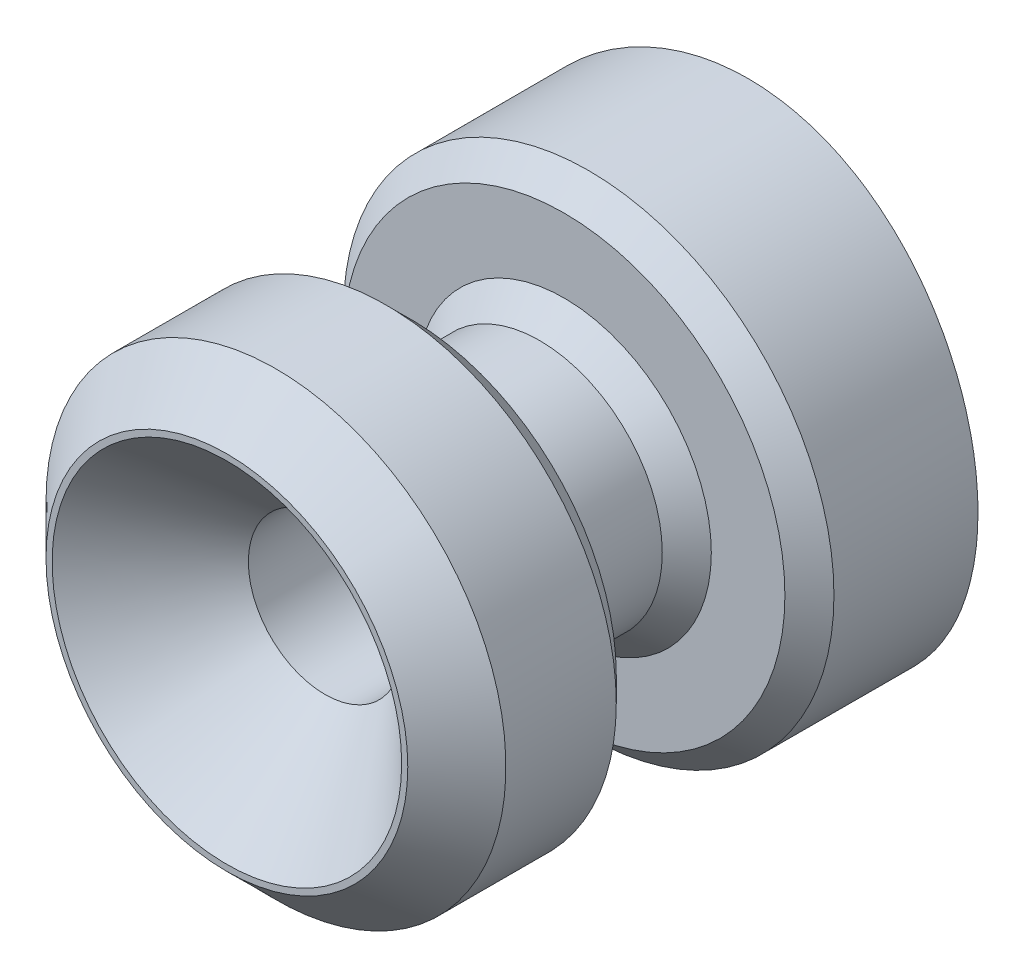
from build123d import *

# Parameters (mm, degrees)
SKETCH1_R               = 5.08
SKETCH1_R_2             = 1.5875
BOSS_EXTRUDE1_DEPTH     = 3.81
SKETCH2_R               = 2.54
SKETCH2_R_2             = 1.5875
BOSS_EXTRUDE2_DEPTH     = 3.175
SKETCH3_R               = 4.7625
SKETCH3_R_2             = 1.5875
BOSS_EXTRUDE3_DEPTH     = 3.81
CHAMFER1_SIZE           = 0.508
CHAMFER2_SIZE           = 0.508
CHAMFER3_SIZE           = 2.032
CUT_EXTRUDE1_DEPTH      = 13.967066939
CUT_EXTRUDE1_DEPTH_BACK = 13.967066939
SKETCH4_R               = 40.64
CHAMFER4_SIZE           = 1.016


with BuildPart() as part:
    # Sketch1 → Boss-Extrude1 (new body)
    with BuildSketch(Plane.XY):
        with Locations(Location((0, 0, 0), (0, 0, 180))):
            Circle(SKETCH1_R)
        with Locations(Location((0, 0, 0), (0, 0, 180))):
            Circle(SKETCH1_R_2, mode=Mode.SUBTRACT)
    extrude(amount=BOSS_EXTRUDE1_DEPTH)

    # Sketch2 → Boss-Extrude2 (add)
    with BuildSketch(Plane.XY.offset(3.81)):
        Circle(SKETCH2_R)
        with Locations(Location((0, 0, 0), (0, 0, 180))):
            Circle(SKETCH2_R_2, mode=Mode.SUBTRACT)
    extrude(amount=BOSS_EXTRUDE2_DEPTH)

    # Sketch3 → Boss-Extrude3 (add)
    with BuildSketch(Plane.XY.offset(6.985)):
        with Locations(Location((0, 0, 0), (0, 0, 180))):
            Circle(SKETCH3_R)
        with Locations(Location((0, 0, 0), (0, 0, 180))):
            Circle(SKETCH3_R_2, mode=Mode.SUBTRACT)
    extrude(amount=BOSS_EXTRUDE3_DEPTH)

    # Chamfer1
    chamfer1_edges = [part.edges().sort_by_distance(p)[0] for p in [
        (-2.54, 0, 6.985),
        (-2.54, 0, 3.81),
    ]]
    chamfer(chamfer1_edges, length=CHAMFER1_SIZE)

    # Chamfer2
    chamfer2_edges = [part.edges().sort_by_distance(p)[0] for p in [
        (4.7625, 0, 6.985),
        (5.08, 0, 3.81),
    ]]
    chamfer(chamfer2_edges, length=CHAMFER2_SIZE)

    # Chamfer3
    chamfer3_edges = [part.edges().sort_by_distance(p)[0] for p in [
        (1.5875, 0, 10.795),
    ]]
    chamfer(chamfer3_edges, length=CHAMFER3_SIZE)

    # Sketch4 → Cut-Extrude1 (cut, two sides: drawn at the far end of the back side and taken through both)
    with BuildSketch(Plane(origin=(0, 0, 0), x_dir=(0, 0, -1), z_dir=(1, 0, 0)).offset(-CUT_EXTRUDE1_DEPTH_BACK)):
        with Locations((40.321249981, 0)):
            Circle(SKETCH4_R)
    extrude(amount=CUT_EXTRUDE1_DEPTH + CUT_EXTRUDE1_DEPTH_BACK, mode=Mode.SUBTRACT)

    # Chamfer4
    chamfer4_edges = [part.edges().sort_by_distance(p)[0] for p in [
        (4.7625, 0, 10.795),
    ]]
    chamfer(chamfer4_edges, length=CHAMFER4_SIZE)


solid = part.part
